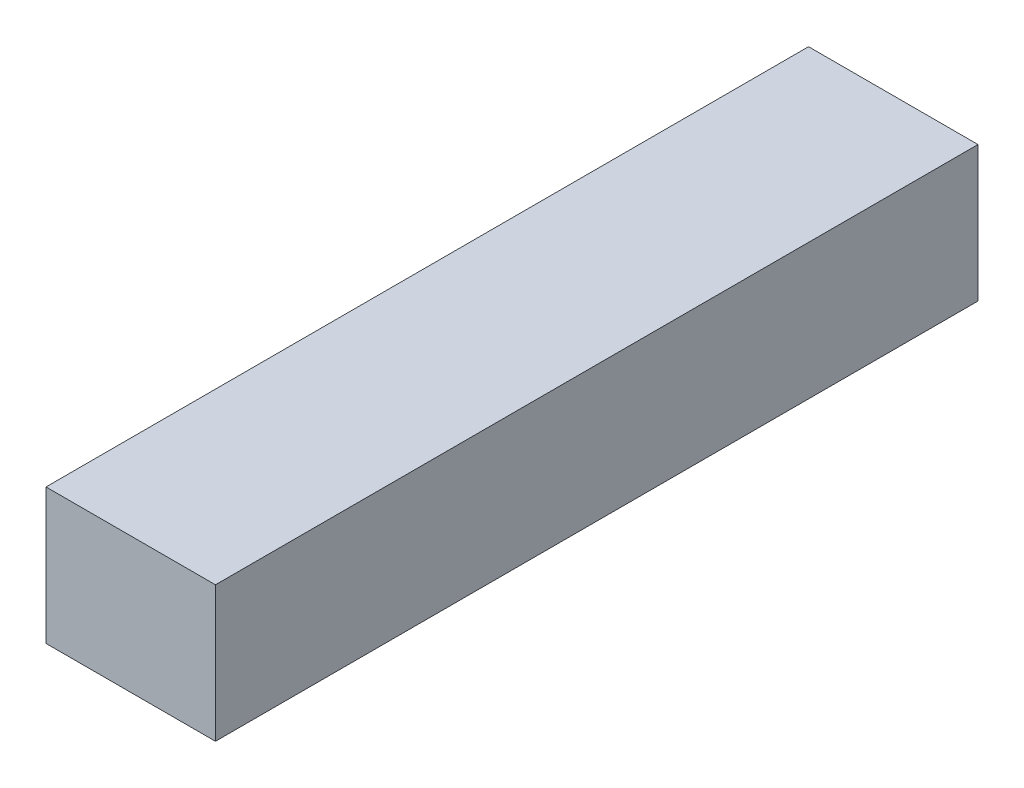
from build123d import *

# Parameters (mm, degrees)
SKETCH1_W           = 10
SKETCH1_H           = 8
BOSS_EXTRUDE1_DEPTH = 45


with BuildPart() as part:
    # Sketch1 → Boss-Extrude1 (new body)
    with BuildSketch(Plane.XY):
        with Locations((5, -4)):
            Rectangle(SKETCH1_W, SKETCH1_H)
    extrude(amount=BOSS_EXTRUDE1_DEPTH)


solid = part.part
